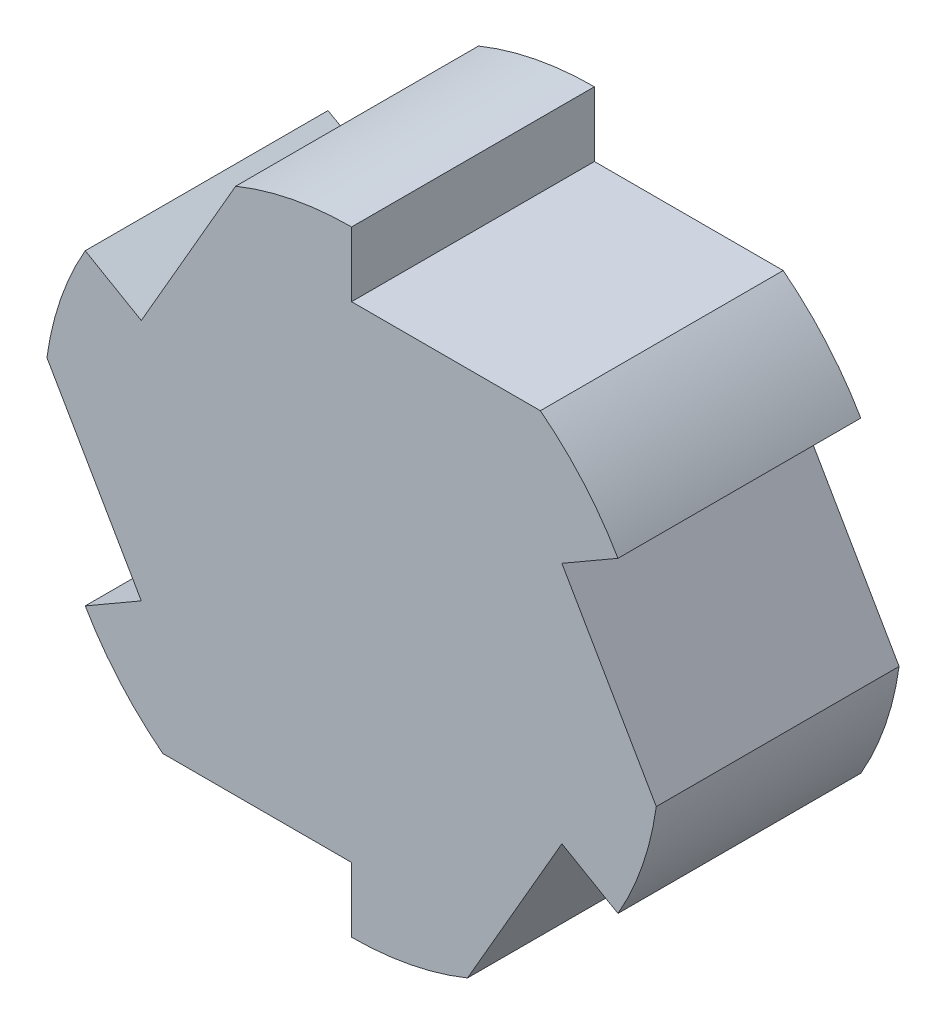
from build123d import *

# Parameters (mm, degrees)
SKETCH1_R           = 30
BOSS_EXTRUDE1_DEPTH = 30


with BuildPart() as part:
    # Sketch1 → Boss-Extrude1 (new body)
    with BuildSketch(Plane.XY):
        with BuildLine():
            ThreePointArc((-25.980762114, 15), (-15, 25.980762114), (0, 30))
            Line((0, 30), (0, 38))
            ThreePointArc((0, 38), (-7.295122504, 37.293178836), (-14.318858324, 35.199009877))
            Line((-14.318858324, 35.199009877), (-25.980762114, 15))
        make_face()
        with BuildLine():
            ThreePointArc((-25.980762114, -15), (-30, 0), (-25.980762114, 15))
            Line((-25.980762114, 15), (-32.908965344, 19))
            ThreePointArc((-32.908965344, 19), (-35.944401511, 12.328828006), (-37.642665903, 5.199009877))
            Line((-37.642665903, 5.199009877), (-25.980762114, -15))
        make_face()
        with BuildLine():
            ThreePointArc((0, -30), (-15, -25.980762114), (-25.980762114, -15))
            Line((-25.980762114, -15), (-32.908965344, -19))
            ThreePointArc((-32.908965344, -19), (-28.649279008, -24.96435083), (-23.323807579, -30))
            Line((-23.323807579, -30), (0, -30))
        make_face()
        with BuildLine():
            Line((14.318858324, -35.199009877), (25.980762114, -15))
            ThreePointArc((25.980762114, -15), (15, -25.980762114), (0, -30))
            Line((0, -30), (0, -38))
            ThreePointArc((0, -38), (7.295122504, -37.293178836), (14.318858324, -35.199009877))
        make_face()
        with BuildLine():
            Line((37.642665903, -5.199009877), (25.980762114, 15))
            ThreePointArc((25.980762114, 15), (28.977774789, 7.764571353), (30, 0))
            ThreePointArc((30, 0), (28.977774789, -7.764571353), (25.980762114, -15))
            Line((25.980762114, -15), (32.908965344, -19))
            ThreePointArc((32.908965344, -19), (35.944401511, -12.328828006), (37.642665903, -5.199009877))
        make_face()
        with BuildLine():
            Line((8.246211251, 30), (0, 30))
            ThreePointArc((0, 30), (15, 25.980762114), (25.980762114, 15))
            Line((25.980762114, 15), (32.908965344, 19))
            ThreePointArc((32.908965344, 19), (28.649279008, 24.96435083), (23.323807579, 30))
            Line((23.323807579, 30), (8.246211251, 30))
        make_face()
        Circle(SKETCH1_R)
    extrude(amount=BOSS_EXTRUDE1_DEPTH)


solid = part.part
